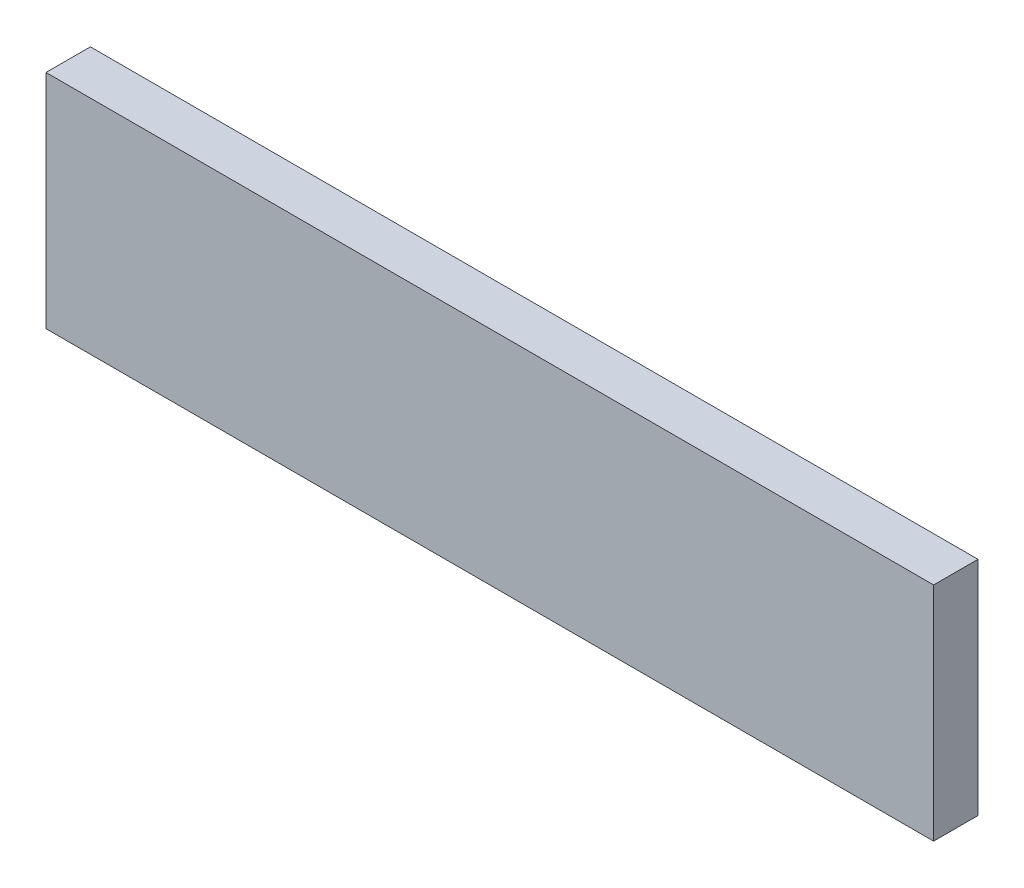
from build123d import *

# Parameters (mm, degrees)
SKETCH1_W      = 80000
SKETCH1_H      = 20000
EXTRUDE1_DEPTH = 4000


with BuildPart() as part:
    # Sketch1 → Extrude1 (new body)
    with BuildSketch(Plane.XY):
        with Locations((40000, 10000)):
            Rectangle(SKETCH1_W, SKETCH1_H)
    extrude(amount=EXTRUDE1_DEPTH)


solid = part.part
